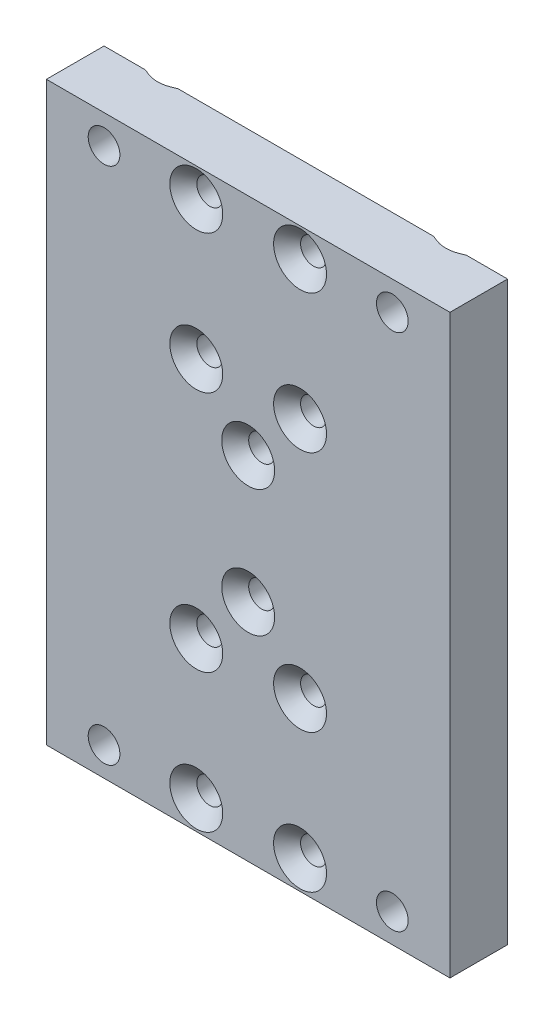
from build123d import *

# Parameters (mm, degrees)
SKETCH1_W                                            = 70
SKETCH1_H                                            = 100
BOSS_EXTRUDE1_DEPTH                                  = 10
SKETCH2_R                                            = 2.5
CUT_EXTRUDE1_DEPTH                                   = 62.846584384
SKETCH3_R                                            = 1.5
CUT_EXTRUDE2_DEPTH                                   = 62.846584384
SKETCH5_R                                            = 2
CUT_EXTRUDE4_DEPTH                                   = 62.846584384
CSK_FOR_M4_SOCKET_COUNTERSUNK_HEAD_SCREW_D           = 4.5
CSK_FOR_M4_SOCKET_COUNTERSUNK_HEAD_SCREW_CSINK_D     = 9.18
CSK_FOR_M4_SOCKET_COUNTERSUNK_HEAD_SCREW_CSINK_ANGLE = 90
CSK_FOR_M5_SOCKET_COUNTERSUNK_HEAD_SCREW_D           = 5.5
CSK_FOR_M5_SOCKET_COUNTERSUNK_HEAD_SCREW_CSINK_D     = 11.47
CSK_FOR_M5_SOCKET_COUNTERSUNK_HEAD_SCREW_CSINK_ANGLE = 90


with BuildPart() as part:
    # Sketch1 → Boss-Extrude1 (new body)
    with BuildSketch(Plane.XY):
        Rectangle(SKETCH1_W, SKETCH1_H)
    extrude(amount=BOSS_EXTRUDE1_DEPTH)

    # Sketch2 → Cut-Extrude1 (cut, through all)
    with BuildSketch(Plane(origin=(0, 0, 0), x_dir=(-1, 0, 0), z_dir=(0, 0, -1))):
        with Locations((-25, 45)):
            Circle(SKETCH2_R)
        with Locations(Location((25, 45, 0), (0, 0, 180))):
            Circle(SKETCH2_R)
        with Locations(Location((-25, -45, 0), (0, 0, 180))):
            Circle(SKETCH2_R)
        with Locations((25, -45)):
            Circle(SKETCH2_R)
    extrude(amount=-CUT_EXTRUDE1_DEPTH, mode=Mode.SUBTRACT)

    # Sketch3 → Cut-Extrude2 (cut, through all)
    with BuildSketch(Plane(origin=(0, 0, 0), x_dir=(-1, 0, 0), z_dir=(0, 0, -1))):
        with Locations((9, 21)):
            Circle(SKETCH3_R)
        with Locations((9, 45)):
            Circle(SKETCH3_R)
        with Locations((-9, 21)):
            Circle(SKETCH3_R)
        with Locations((-9, 45)):
            Circle(SKETCH3_R)
        with Locations((9, -45)):
            Circle(SKETCH3_R)
        with Locations((9, -21)):
            Circle(SKETCH3_R)
        with Locations((-9, -45)):
            Circle(SKETCH3_R)
        with Locations((-9, -21)):
            Circle(SKETCH3_R)
    extrude(amount=-CUT_EXTRUDE2_DEPTH, mode=Mode.SUBTRACT)

    # Sketch5 → Cut-Extrude4 (cut, through all)
    with BuildSketch(Plane.XY.offset(10)):
        with Locations((0, -11)):
            Circle(SKETCH5_R)
        with Locations((0, 11)):
            Circle(SKETCH5_R)
    extrude(amount=-CUT_EXTRUDE4_DEPTH, mode=Mode.SUBTRACT)

    # CSK for M4 socket countersunk head screw1 (through all)
    with Locations(Plane.XY.offset(10)):
        with Locations((-9, 45), (9, 45), (9, 21), (-9, 21), (0, 11), (0, -11), (9, -21), (-9, -21), (-9, -45), (9, -45)):
            CounterSinkHole(CSK_FOR_M4_SOCKET_COUNTERSUNK_HEAD_SCREW_D / 2, CSK_FOR_M4_SOCKET_COUNTERSUNK_HEAD_SCREW_CSINK_D / 2, counter_sink_angle=CSK_FOR_M4_SOCKET_COUNTERSUNK_HEAD_SCREW_CSINK_ANGLE)

    # CSK for M5 socket countersunk head screw2 (through all)
    with Locations(Plane(origin=(0, 0, 0), x_dir=(-1, 0, 0), z_dir=(0, 0, -1))):
        with Locations((-25, 45), (25, 45), (25, -45), (-25, -45)):
            CounterSinkHole(CSK_FOR_M5_SOCKET_COUNTERSUNK_HEAD_SCREW_D / 2, CSK_FOR_M5_SOCKET_COUNTERSUNK_HEAD_SCREW_CSINK_D / 2, counter_sink_angle=CSK_FOR_M5_SOCKET_COUNTERSUNK_HEAD_SCREW_CSINK_ANGLE)


solid = part.part
